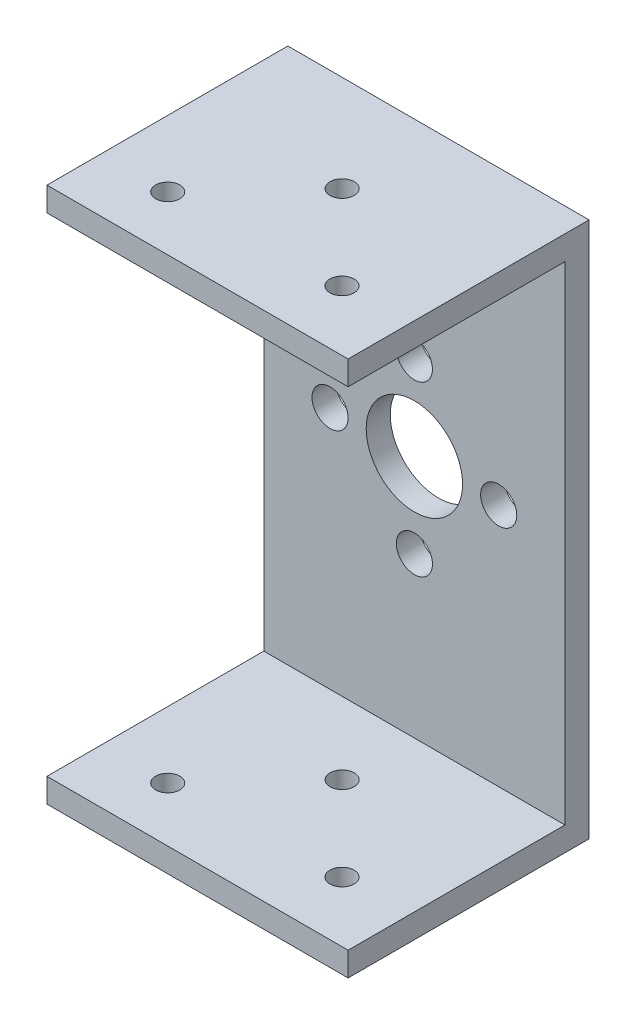
from build123d import *

# Parameters (mm, degrees)
SKETCH1_W           = 25
SKETCH1_H           = 40.5
BOSS_EXTRUDE1_DEPTH = 2
SKETCH2_W           = 25
SKETCH2_H           = 20
BOSS_EXTRUDE2_DEPTH = 2
SKETCH3_W           = 25
SKETCH3_H           = 20
BOSS_EXTRUDE3_DEPTH = 2
SKETCH5_R           = 4
CUT_EXTRUDE2_DEPTH  = 21
SKETCH6_R           = 1.5
CUT_EXTRUDE3_DEPTH  = 21
SKETCH7_R           = 1
CUT_EXTRUDE4_DEPTH  = 55


with BuildPart() as part:
    # Sketch1 → Boss-Extrude1 (new body)
    with BuildSketch(Plane.XY):
        with Locations((-0.174770451, 10.252942624)):
            Rectangle(SKETCH1_W, SKETCH1_H)
    extrude(amount=BOSS_EXTRUDE1_DEPTH)

    # Sketch2 → Boss-Extrude2 (add)
    with BuildSketch(Plane(origin=(0, 30.502942624, 0), x_dir=(1, 0, 0), z_dir=(0, 1, 0))):
        with Locations((-0.174770451, -10)):
            Rectangle(SKETCH2_W, SKETCH2_H)
    extrude(amount=BOSS_EXTRUDE2_DEPTH)

    # Sketch3 → Boss-Extrude3 (add)
    with BuildSketch(Plane(origin=(0, -9.997057376, 0), x_dir=(-1, 0, 0), z_dir=(0, -1, 0))):
        with Locations((0.174770451, -10)):
            Rectangle(SKETCH3_W, SKETCH3_H)
    extrude(amount=BOSS_EXTRUDE3_DEPTH)

    # Sketch5 → Cut-Extrude2 (cut)
    with BuildSketch(Plane(origin=(0, 0, 0), x_dir=(-1, 0, 0), z_dir=(0, 0, -1))):
        with Locations((0.174770451, 10.252942624)):
            Circle(SKETCH5_R)
    extrude(amount=-CUT_EXTRUDE2_DEPTH, mode=Mode.SUBTRACT)

    # Sketch6 → Cut-Extrude3 (cut)
    with BuildSketch(Plane(origin=(0, 0, 0), x_dir=(-1, 0, 0), z_dir=(0, 0, -1))):
        with Locations((7.174770451, 10.252942624)):
            Circle(SKETCH6_R)
        with Locations((0.174770451, 3.252942624)):
            Circle(SKETCH6_R)
        with Locations((-6.825229549, 10.252942624)):
            Circle(SKETCH6_R)
        with Locations((0.174770451, 17.252942624)):
            Circle(SKETCH6_R)
    extrude(amount=-CUT_EXTRUDE3_DEPTH, mode=Mode.SUBTRACT)

    # Sketch7 → Cut-Extrude4 (cut)
    with BuildSketch(Plane(origin=(0, -11.997057376, 0), x_dir=(-1, 0, 0), z_dir=(0, -1, 0))):
        with Locations(Location((7.174770451, -15.473202344, 0), (0, 0, 90))):
            Circle(SKETCH7_R)
        with Locations(Location((-6.817230105, -15, 0), (0, 0, 90))):
            Circle(SKETCH7_R)
        with Locations(Location((0.174770451, -8, 0), (0, 0, 90))):
            Circle(SKETCH7_R)
    extrude(amount=-CUT_EXTRUDE4_DEPTH, mode=Mode.SUBTRACT)


solid = part.part
